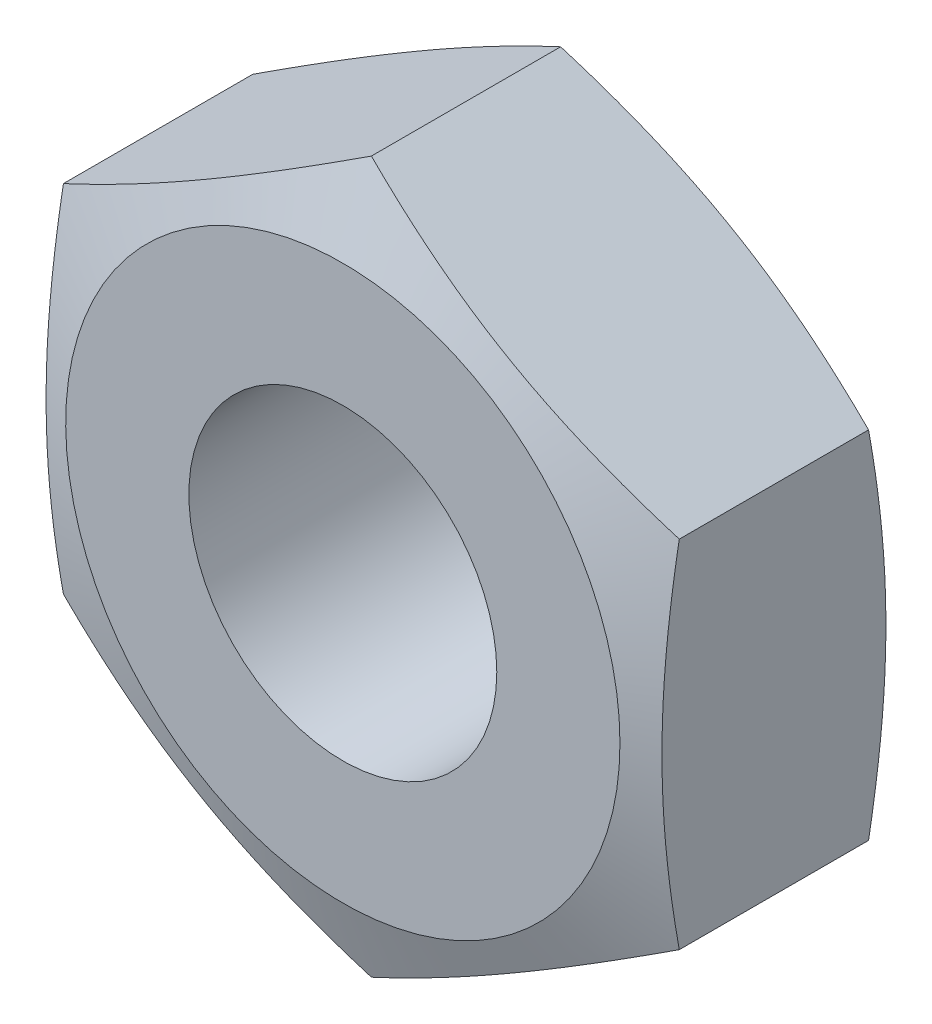
from build123d import *

# Parameters (mm, degrees)
EXTRUDE_1_DEPTH     = 1.6
SKETCH_5_R          = 1
CUT_EXTRUDE_1_DEPTH = 4.448671242


with BuildPart() as part:
    # 草图1 → 凸台-拉伸1 (new body)
    with BuildSketch(Plane.XY):
        Polygon((0, 2.309401077), (-2, 1.154700538), (-2, -1.154700538), (0, -2.309401077), (2, -1.154700538), (2, 1.154700538), align=None)
    extrude(amount=EXTRUDE_1_DEPTH)

    # 草图4 → 切除-旋转1 (revolve, cut)
    with BuildSketch(Plane(origin=(0, 0, 0), x_dir=(0, 0, -1), z_dir=(1, 0, 0))):
        Polygon((-1.6, -1.8), (-1.414593171, -2.309401077), (-1.6, -2.309401077), align=None)
    cut_revolve_1 = revolve(axis=Axis((0, 0, 1.6), (0, 0, -1)), mode=Mode.SUBTRACT)

    # 镜向1: 切除-旋转1 across plane
    add(cut_revolve_1.mirror(Plane.XY.offset(0.8)), mode=Mode.SUBTRACT)

    # 草图5 → 切除-拉伸1 (cut, through all)
    with BuildSketch(Plane.XY.offset(1.6)):
        Circle(SKETCH_5_R)
    extrude(amount=-CUT_EXTRUDE_1_DEPTH, mode=Mode.SUBTRACT)


solid = part.part
